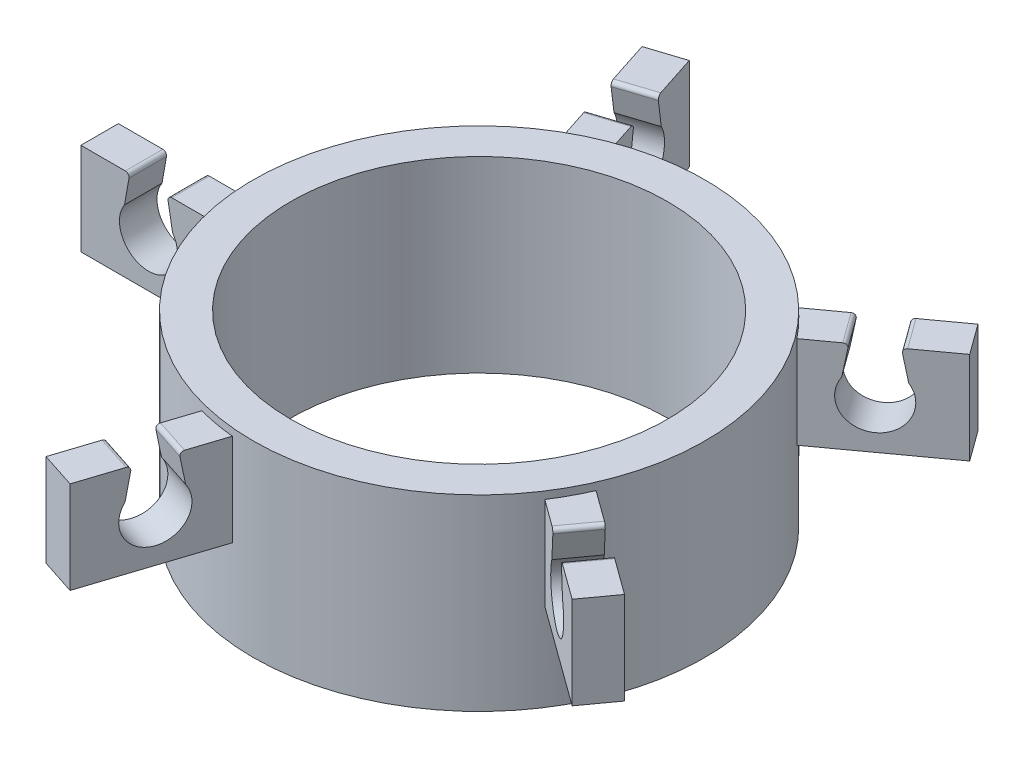
from build123d import *

# Parameters (mm, degrees)
ESQUISSE1_R                      = 12.05
ESQUISSE1_R_2                    = 10.05
BASE_DEPTH                       = 10
BOSS_TIGE_DEPTH                  = 2
CONGE_TIGE_R                     = 0.2
REP_SUPPORT_TIGE_COUNT           = 5
CONGE_TIGE_OF_REP_SUPPORT_TIGE_R = 0.2


with BuildPart() as part:
    # Esquisse1 → BASE (new body)
    with BuildSketch(Plane(origin=(0, 0, 0), x_dir=(1, 0, 0), z_dir=(0, 1, 0))):
        Circle(ESQUISSE1_R)
        Circle(ESQUISSE1_R_2, mode=Mode.SUBTRACT)
    extrude(amount=BASE_DEPTH)

    # Esquisse7 → BOSS TIGE (add)
    with BuildSketch(Plane(origin=(0, 0, 2.6), x_dir=(-1, 0, 0), z_dir=(0, 0, -1))):
        with BuildLine():
            Line((14.022631891, 9.608391049), (11.415742159, 9.608391049))
            Line((11.415742159, 9.608391049), (11.415742159, 4.685414017))
            Line((11.415742159, 4.685414017), (18.629521623, 4.685414017))
            Line((18.629521623, 4.685414017), (18.629521623, 9.608391049))
            Line((18.629521623, 9.608391049), (16.022631891, 9.608391049))
            Line((16.022631891, 9.608391049), (16.302913172, 8.020618644))
            ThreePointArc((16.302913172, 8.020618644), (15.022631891, 5.596902533), (13.742350611, 8.020618644))
            Line((13.742350611, 8.020618644), (14.022631891, 9.608391049))
        make_face()
    boss_tige = extrude(amount=BOSS_TIGE_DEPTH)

    # CONGE TIGE
    conge_tige_edges = [part.edges().sort_by_distance(p)[0] for p in [
        (-16.022631891, 9.608391049, 1.6),
        (-14.022631891, 9.608391049, 1.6),
    ]]
    fillet(conge_tige_edges, radius=CONGE_TIGE_R)

    # REP SUPPORT TIGE: BOSS TIGE ×5 about axis
    rep_support_tige_axis = Axis((0, 10, 0), (0, -1, 0))
    for i in range(1, REP_SUPPORT_TIGE_COUNT):
        add(boss_tige.rotate(rep_support_tige_axis, i * 360 / REP_SUPPORT_TIGE_COUNT))

    # CONGE TIGE of REP SUPPORT TIGE
    conge_tige_of_rep_support_tige_edges = [part.edges().sort_by_distance(p)[0] for p in [
        (-6.472955975, 9.608391049, -14.744001277),
        (-5.854921986, 9.608391049, -12.841888245),
        (12.022125091, 9.608391049, -10.712293919),
        (10.404091102, 9.608391049, -9.536723415),
        (13.903037898, 9.608391049, 8.123439537),
        (12.285003909, 9.608391049, 6.947869033),
        (-3.429575123, 9.608391049, 15.732855659),
        (-2.811541134, 9.608391049, 13.830742627),
    ]]
    fillet(conge_tige_of_rep_support_tige_edges, radius=CONGE_TIGE_OF_REP_SUPPORT_TIGE_R)


solid = part.part
